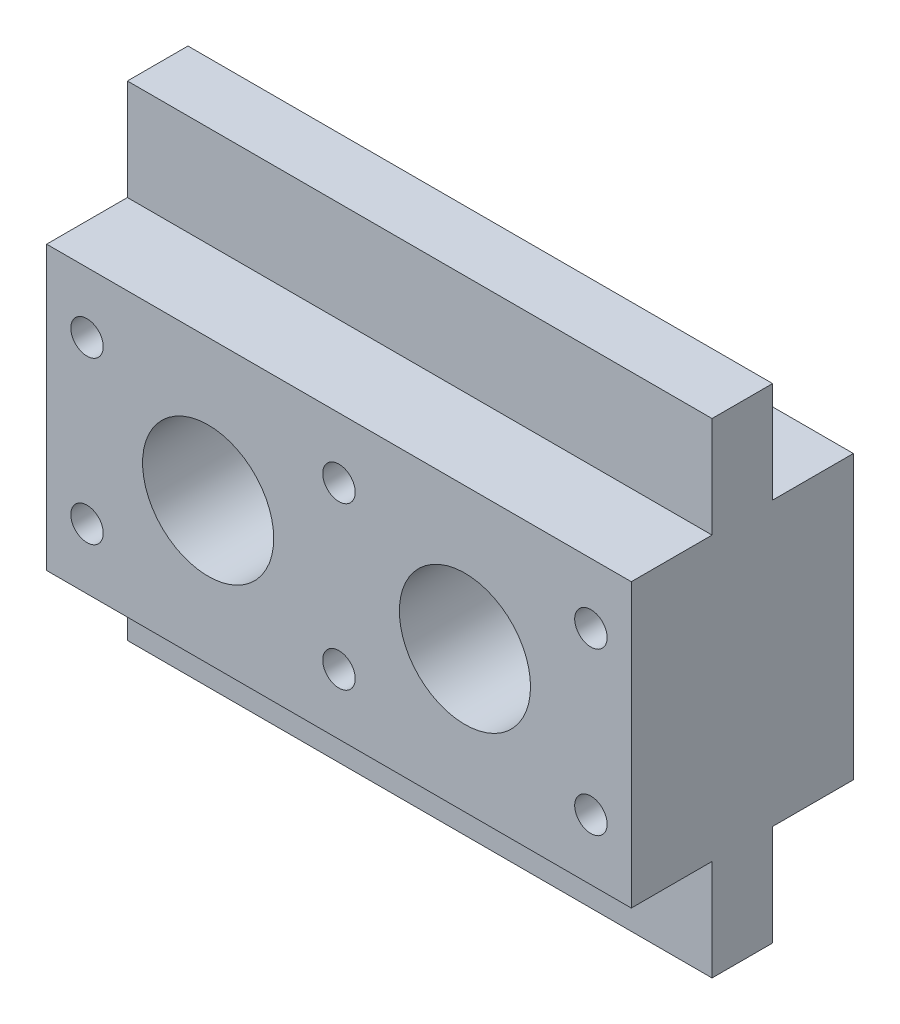
from build123d import *

# Parameters (mm, degrees)
SKETCH1_W           = 91.948
SKETCH1_H           = 76.2
BOSS_EXTRUDE1_DEPTH = 4.7625
BOSS_EXTRUDE2_START = -4.7625
SKETCH2_W           = 91.948
SKETCH2_H           = 44.45
BOSS_EXTRUDE2_DEPTH = 12.7
SKETCH3_R           = 10.3124
CUT_EXTRUDE6_DEPTH  = 125.421181191
SKETCH4_R           = 2.5527
CUT_EXTRUDE7_DEPTH  = 12.7


with BuildPart() as part:
    # Sketch1 → Boss-Extrude1 (new body)
    with BuildSketch(Plane.XY):
        with Locations((45.974, 38.1)):
            Rectangle(SKETCH1_W, SKETCH1_H)
    boss_extrude1 = extrude(amount=BOSS_EXTRUDE1_DEPTH)

    # Sketch2 → Boss-Extrude2 (add)
    with BuildSketch(Plane(origin=(0, 0, 0), x_dir=(-1, 0, 0), z_dir=(0, 0, -1)).offset(BOSS_EXTRUDE2_START)):
        with Locations((-45.974, 38.1)):
            Rectangle(SKETCH2_W, SKETCH2_H)
    boss_extrude2 = extrude(amount=-BOSS_EXTRUDE2_DEPTH)

    # Mirror1: Boss-Extrude1, Boss-Extrude2 across plane
    add(boss_extrude1.mirror(Plane.XY))
    add(boss_extrude2.mirror(Plane.XY))

    # Sketch3 → Cut-Extrude6 (cut, through all)
    with BuildSketch(Plane.XY.offset(17.4625)):
        with Locations((25.4, 38.1)):
            Circle(SKETCH3_R)
        with Locations((65.786, 38.1)):
            Circle(SKETCH3_R)
    extrude(amount=-CUT_EXTRUDE6_DEPTH, mode=Mode.SUBTRACT)

    # Sketch4 → Cut-Extrude7 (cut)
    with BuildSketch(Plane.XY.offset(17.4625)):
        with Locations((6.35, 50.8)):
            Circle(SKETCH4_R)
        with Locations((6.35, 25.4)):
            Circle(SKETCH4_R)
        with Locations((45.974, 25.4)):
            Circle(SKETCH4_R)
        with Locations((45.974, 50.8)):
            Circle(SKETCH4_R)
        with Locations((85.598, 50.8)):
            Circle(SKETCH4_R)
        with Locations((85.598, 25.4)):
            Circle(SKETCH4_R)
    extrude(amount=-CUT_EXTRUDE7_DEPTH, mode=Mode.SUBTRACT)


solid = part.part
